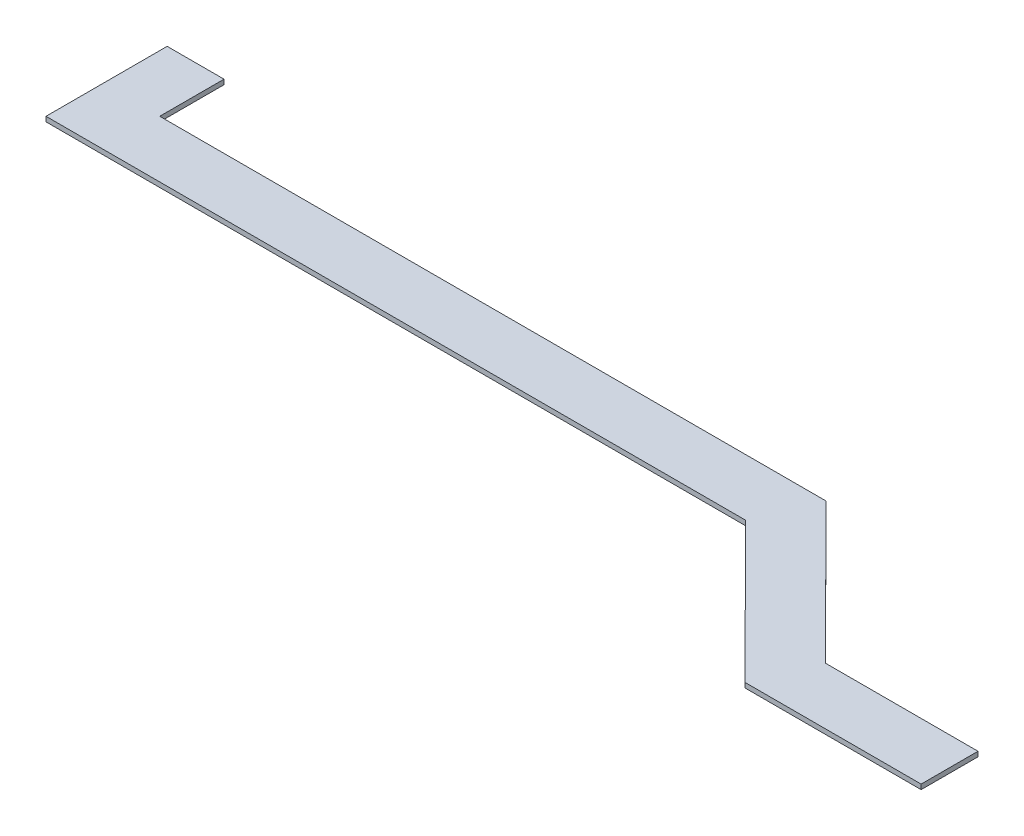
from build123d import *

# Parameters (mm, degrees)
BOSS_EXTRUDE1_DEPTH = 0.3


with BuildPart() as part:
    # Sketch1 → Boss-Extrude1 (new body)
    with BuildSketch(Plane(origin=(0, 0, 0), x_dir=(1, 0, 0), z_dir=(0, 1, 0))):
        Polygon((0, 0), (0, -7.5), (43.3004, -7.5), (51.9868, -16.213638088), (62.8868, -16.213638088), (62.8868, -12.693638088), (53.448060598, -12.693638088), (44.761660598, -3.98), (3.52, -3.98), (3.52, 0), align=None)
    extrude(amount=BOSS_EXTRUDE1_DEPTH)


solid = part.part
